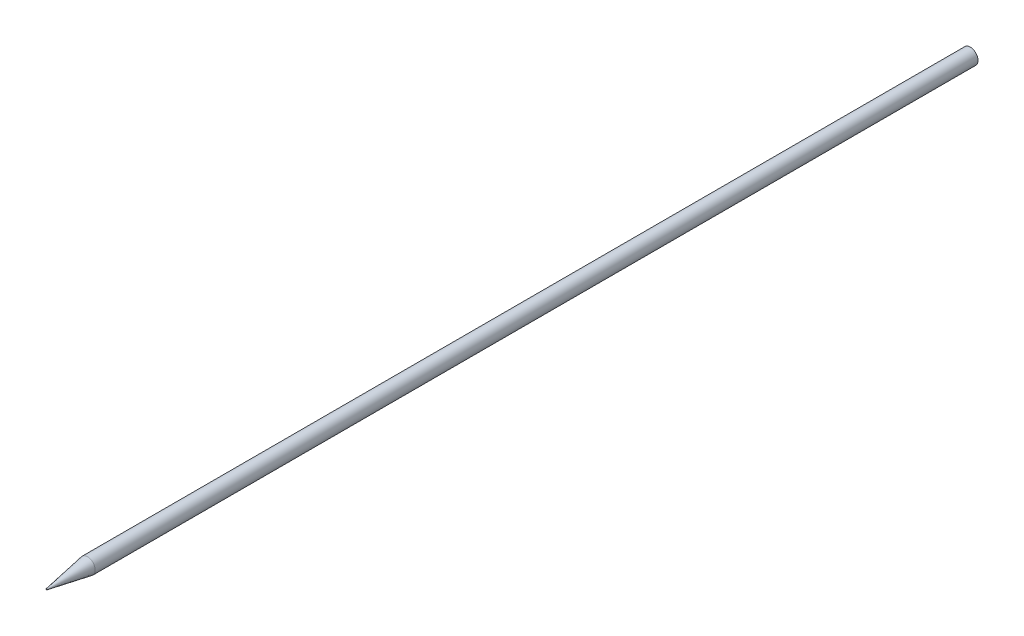
from build123d import *

# Parameters (mm, degrees)
SKETCH1_R           = 0.1905
BOSS_EXTRUDE1_DEPTH = 22.86
CHAMFER1_SIZE       = 1.016
CHAMFER1_SIZE2      = 0.179148212


with BuildPart() as part:
    # Sketch1 → Boss-Extrude1 (new body)
    with BuildSketch(Plane.XY):
        Circle(SKETCH1_R)
    extrude(amount=BOSS_EXTRUDE1_DEPTH)

    # Chamfer1
    chamfer1_edges = [part.edges().sort_by_distance(p)[0] for p in [
        (-0.1905, 0, 22.86),
    ]]
    chamfer1_side = [part.faces().sort_by_distance(p)[0] for p in [
        (-0.1905, 0, 11.43),
    ]]
    chamfer(chamfer1_edges, length=CHAMFER1_SIZE, length2=CHAMFER1_SIZE2, reference=chamfer1_side[0])


solid = part.part
